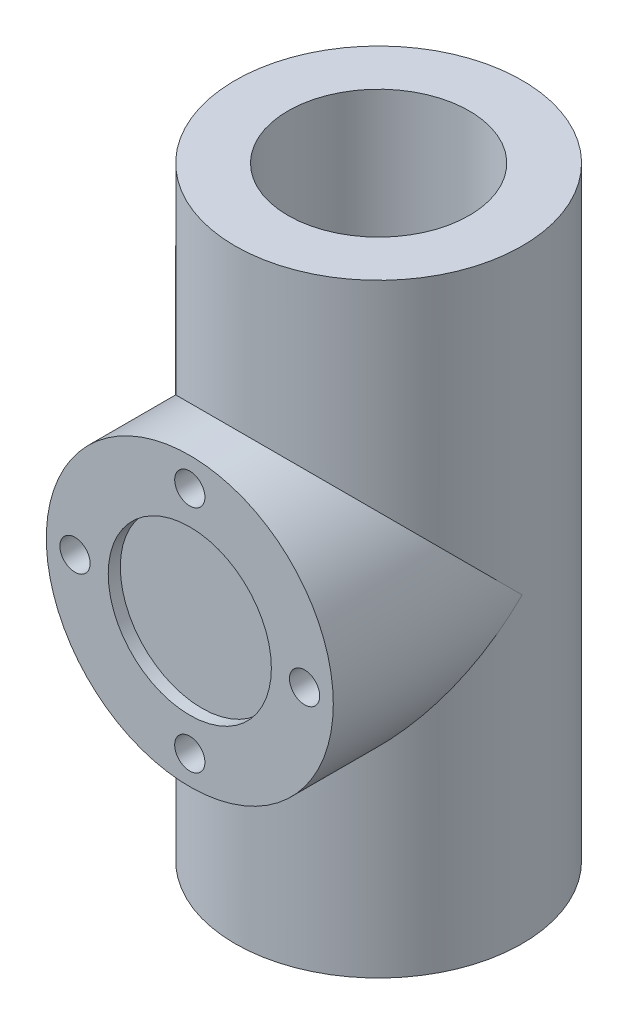
from build123d import *

# Parameters (mm, degrees)
SKETCH1_R           = 47.5
BOSS_EXTRUDE1_DEPTH = 200
SKETCH2_R           = 30
CUT_EXTRUDE2_DEPTH  = 200
SKETCH4_R           = 47.5
BOSS_EXTRUDE2_DEPTH = 62.5
SKETCH5_R           = 5
CUT_EXTRUDE3_DEPTH  = 20
SKETCH6_R           = 27
CUT_EXTRUDE4_DEPTH  = 4


with BuildPart() as part:
    # Sketch1 → Boss-Extrude1 (new body)
    with BuildSketch(Plane(origin=(0, 0, 0), x_dir=(1, 0, 0), z_dir=(0, 1, 0))):
        with Locations(Location((0, 0, 0), (0, 0, 270))):
            Circle(SKETCH1_R)
    extrude(amount=BOSS_EXTRUDE1_DEPTH)

    # Sketch2 → Cut-Extrude2 (cut)
    with BuildSketch(Plane(origin=(0, 200, 0), x_dir=(1, 0, 0), z_dir=(0, 1, 0))):
        with Locations(Location((0, 0, 0), (0, 0, 270))):
            Circle(SKETCH2_R)
    extrude(amount=-CUT_EXTRUDE2_DEPTH, mode=Mode.SUBTRACT)

    # Sketch4 → Boss-Extrude2 (add)
    with BuildSketch(Plane.XY):
        with Locations((0, 100)):
            Circle(SKETCH4_R)
    extrude(amount=BOSS_EXTRUDE2_DEPTH)

    # Sketch5 → Cut-Extrude3 (cut)
    with BuildSketch(Plane.XY.offset(62.5)):
        with Locations((0, 138)):
            Circle(SKETCH5_R)
        with Locations((0, 62)):
            Circle(SKETCH5_R)
        with Locations((38, 100)):
            Circle(SKETCH5_R)
        with Locations((-38, 100)):
            Circle(SKETCH5_R)
    extrude(amount=-CUT_EXTRUDE3_DEPTH, mode=Mode.SUBTRACT)

    # Sketch6 → Cut-Extrude4 (cut)
    with BuildSketch(Plane.XY.offset(62.5)):
        with Locations((0, 100)):
            Circle(SKETCH6_R)
    extrude(amount=-CUT_EXTRUDE4_DEPTH, mode=Mode.SUBTRACT)


solid = part.part
